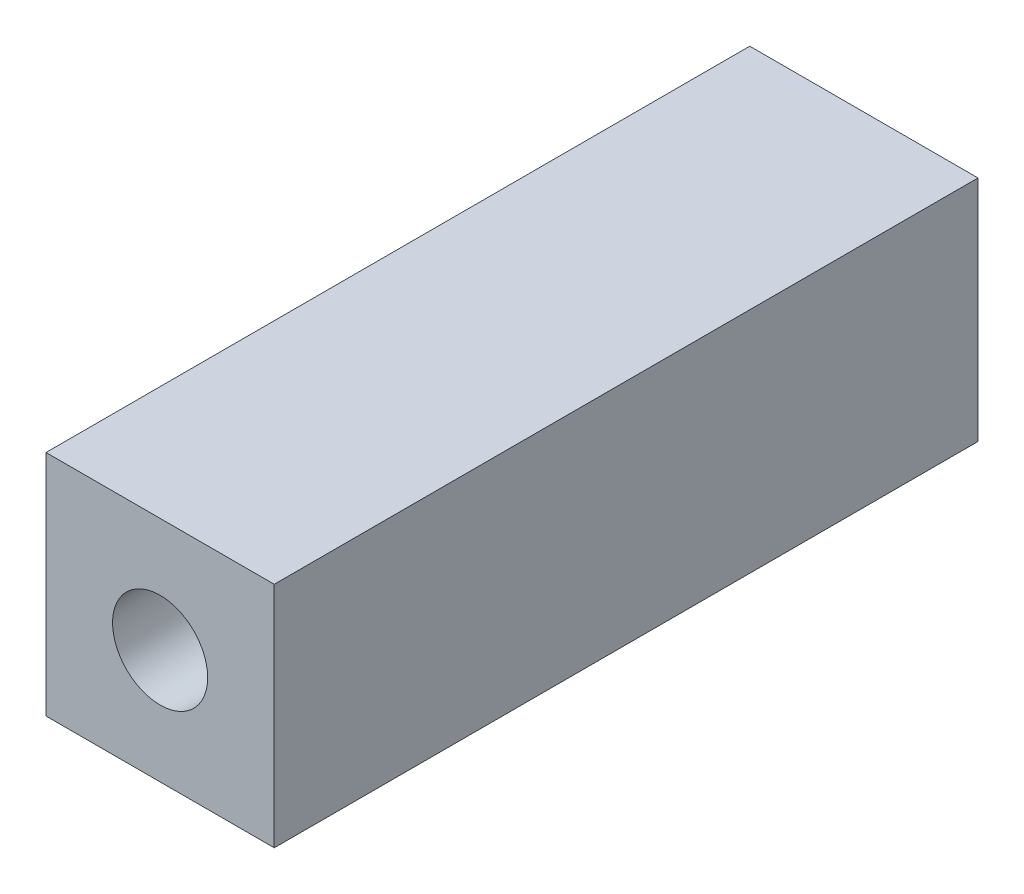
from build123d import *

# Parameters (mm, degrees)
SKETCH1_W           = 12
SKETCH1_H           = 12
BOSS_EXTRUDE1_DEPTH = 37
SKETCH2_W           = 8
SKETCH2_H           = 8
CUT_EXTRUDE1_DEPTH  = 30
CUT_EXTRUDE2_REACH  = 39.961
SKETCH3_R           = 2.5


with BuildPart() as part:
    # Sketch1 → Boss-Extrude1 (new body)
    with BuildSketch(Plane.XY):
        Rectangle(SKETCH1_W, SKETCH1_H)
    extrude(amount=BOSS_EXTRUDE1_DEPTH)

    # Sketch2 → Cut-Extrude1 (cut)
    with BuildSketch(Plane(origin=(0, 0, 0), x_dir=(-1, 0, 0), z_dir=(0, 0, -1))):
        Rectangle(SKETCH2_W, SKETCH2_H)
    extrude(amount=-CUT_EXTRUDE1_DEPTH, mode=Mode.SUBTRACT)

    # Sketch3 → Cut-Extrude2 (cut, up to next)
    with BuildSketch(Plane.XY.offset(37), mode=Mode.PRIVATE) as cut_extrude2_sk1:
        Circle(SKETCH3_R)
    cut_extrude2_tool1 = extrude(cut_extrude2_sk1.sketch, amount=-CUT_EXTRUDE2_REACH, mode=Mode.PRIVATE) & part.part
    add(cut_extrude2_tool1.solids().sort_by_distance((0, 0, 37))[0], mode=Mode.SUBTRACT)


solid = part.part
